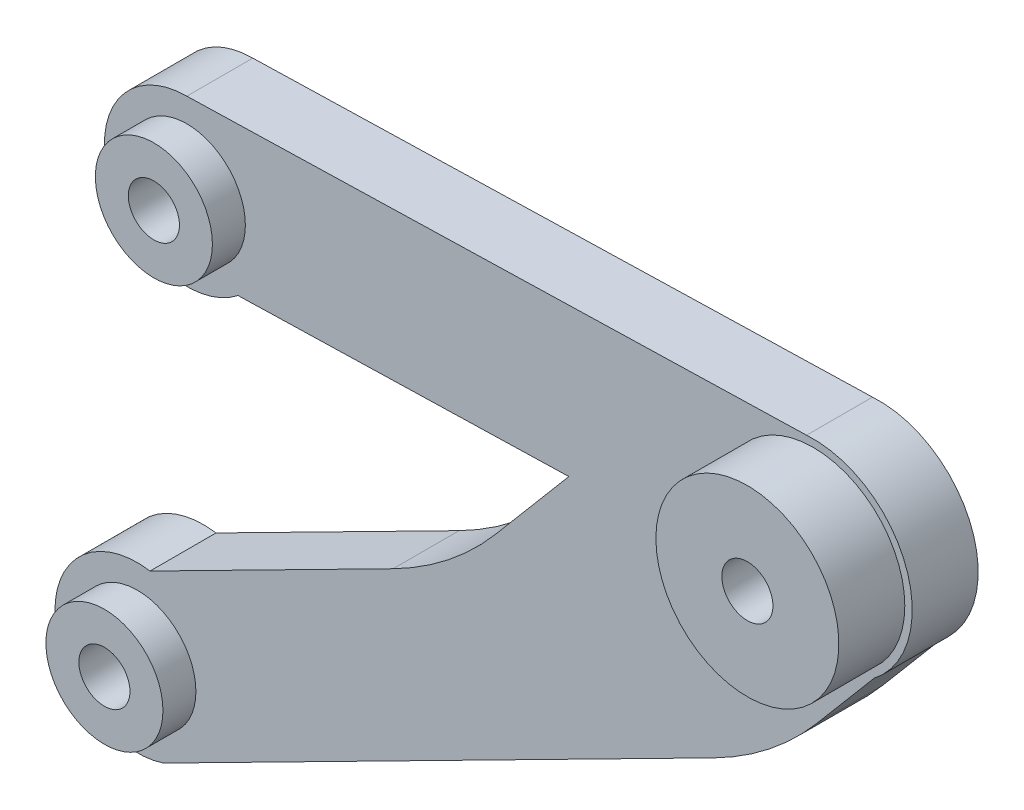
from build123d import *

# Parameters (mm, degrees)
BOSS_EXTRUDE1_DEPTH      = 2
BOSS_EXTRUDE1_DEPTH_BACK = 2
SKETCH2_R                = 1.55
FILLET1_R                = 20
SKETCH7_R                = 5.55
SKETCH7_R_2              = 1.55
BOSS_EXTRUDE4_DEPTH      = 4
SKETCH8_R                = 3.55
SKETCH8_R_2              = 1.55
BOSS_EXTRUDE5_DEPTH      = 2


with BuildPart() as part:
    # Sketch2 → Boss-Extrude1 (new, two sides: drawn at the far end of the back side and taken through both)
    with BuildSketch(Plane.XY.offset(-BOSS_EXTRUDE1_DEPTH_BACK)):
        with BuildLine():
            ThreePointArc((0.76923556, 4.940473323), (-4.982755324, -0.41490888), (1.575752274, -4.745208612))
            Line((1.575752274, -4.745208612), (38.598254294, 14.069940073))
            Line((38.598254294, 14.069940073), (44.683748534, 21.26396825))
            ThreePointArc((44.683748534, 21.26396825), (46.605489471, 28.139740122), (40.590896347, 31.986036602))
            Line((40.590896347, 31.986036602), (3, 31))
            ThreePointArc((3, 31), (-1.722747684, 24.35815521), (6.101607472, 22.078261726))
            Line((6.101607472, 22.078261726), (26.170960727, 22.604695486))
            Line((26.170960727, 22.604695486), (19.115779569, 14.264342174))
            Line((19.115779569, 14.264342174), (0.76923556, 4.940473323))
        make_face()
        Circle(SKETCH2_R, mode=Mode.SUBTRACT)
        with Locations((3, 26)):
            Circle(SKETCH2_R, mode=Mode.SUBTRACT)
        with Locations((41, 26)):
            Circle(SKETCH2_R, mode=Mode.SUBTRACT)
    extrude(amount=BOSS_EXTRUDE1_DEPTH + BOSS_EXTRUDE1_DEPTH_BACK)

    # Fillet1
    fillet1_edges = [part.edges().sort_by_distance(p)[0] for p in [
        (38.598254294, 14.069940073, 0),
        (19.115779569, 14.264342174, 0),
    ]]
    fillet(fillet1_edges, radius=FILLET1_R)

    # Sketch7 → Boss-Extrude4 (add)
    with BuildSketch(Plane(origin=(0, 0, 2), x_dir=(-1, 0, 0), z_dir=(0, 0, -1))):
        with Locations((-41, 26)):
            Circle(SKETCH7_R)
        with Locations((-41, 26)):
            Circle(SKETCH7_R_2, mode=Mode.SUBTRACT)
    extrude(amount=-BOSS_EXTRUDE4_DEPTH)

    # Sketch8 → Boss-Extrude5 (add)
    # profile 1 of 2: a face of its own
    with BuildSketch(Plane.XY.offset(2)):
        with Locations((3, 26)):
            Circle(SKETCH8_R)
        with Locations((3, 26)):
            Circle(SKETCH8_R_2, mode=Mode.SUBTRACT)
    # profile 2 of 2: a face of its own
    with BuildSketch(Plane.XY.offset(2)):
        Circle(SKETCH8_R)
        Circle(SKETCH8_R_2, mode=Mode.SUBTRACT)
    extrude(amount=BOSS_EXTRUDE5_DEPTH)


solid = part.part
